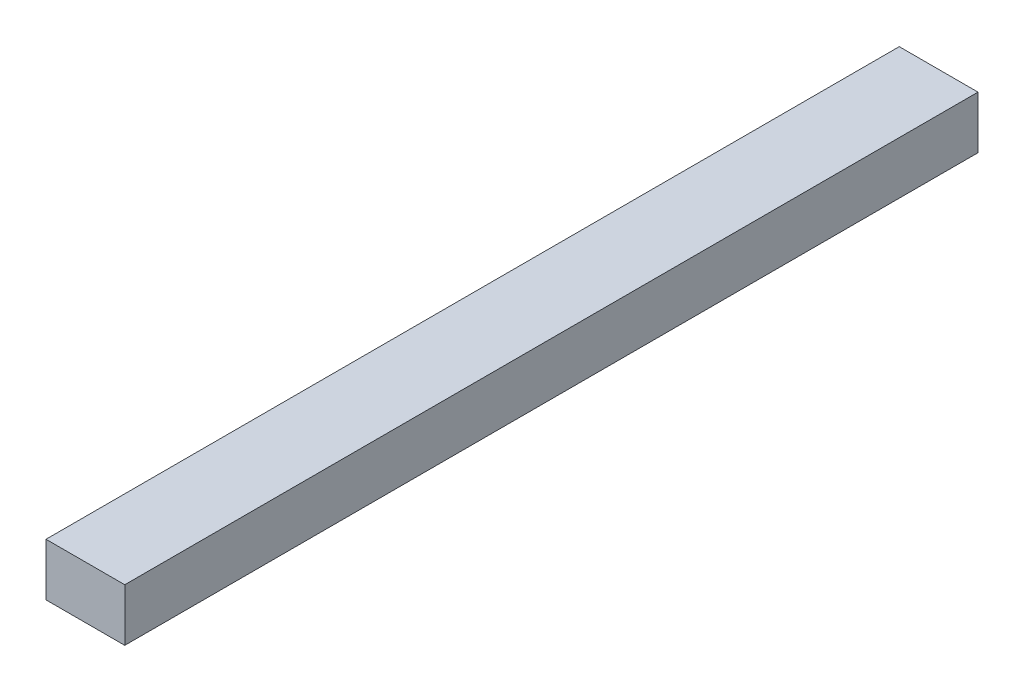
from build123d import *

# Parameters (mm, degrees)
SKETCH1_W           = 120
SKETCH1_H           = 80
BOSS_EXTRUDE1_DEPTH = 1300


with BuildPart() as part:
    # Sketch1 → Boss-Extrude1 (new body)
    with BuildSketch(Plane.XY):
        with Locations((37.119808193, -6.55015437)):
            Rectangle(SKETCH1_W, SKETCH1_H)
    extrude(amount=BOSS_EXTRUDE1_DEPTH)


solid = part.part
